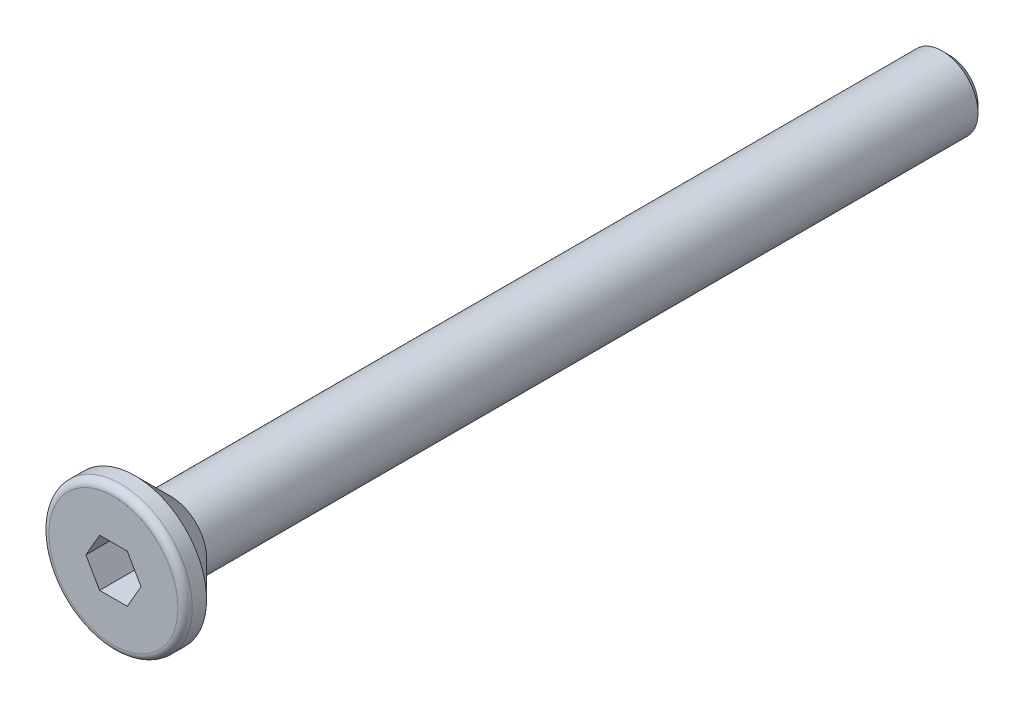
from build123d import *

# Parameters (mm, degrees)
CUT_EXTRUDE_1_DEPTH = 1.5
FILLET_1_R          = 0.3


with BuildPart() as part:
    # 草图1 → 旋转1 (revolve)
    with BuildSketch(Plane(origin=(0, 0, 0), x_dir=(0, 0, -1), z_dir=(1, 0, 0)), mode=Mode.PRIVATE) as revolve_1_sk:
        Polygon((-17.5, 0), (-17.5, 3), (-16.6, 3), (-15.1, 1.5), (17.2, 1.5), (17.5, 1.2), (17.5, 0), align=None)
    revolve(revolve_1_sk.sketch.rotate(Axis((0, 0, -17.5), (0, 0, 1)), 90), axis=Axis((0, 0, -17.5), (0, 0, 1)))

    # 草图2 → 切除-拉伸1 (cut)
    with BuildSketch(Plane.XY.offset(17.5)):
        Polygon((1.154700538, 0), (0.577350269, 1), (-0.577350269, 1), (-1.154700538, 0), (-0.577350269, -1), (0.577350269, -1), align=None)
    extrude(amount=-CUT_EXTRUDE_1_DEPTH, mode=Mode.SUBTRACT)

    # 圆角1
    fillet_1_edges = [part.edges().sort_by_distance(p)[0] for p in [
        (3, 0, 17.5),
    ]]
    fillet(fillet_1_edges, radius=FILLET_1_R)


solid = part.part
